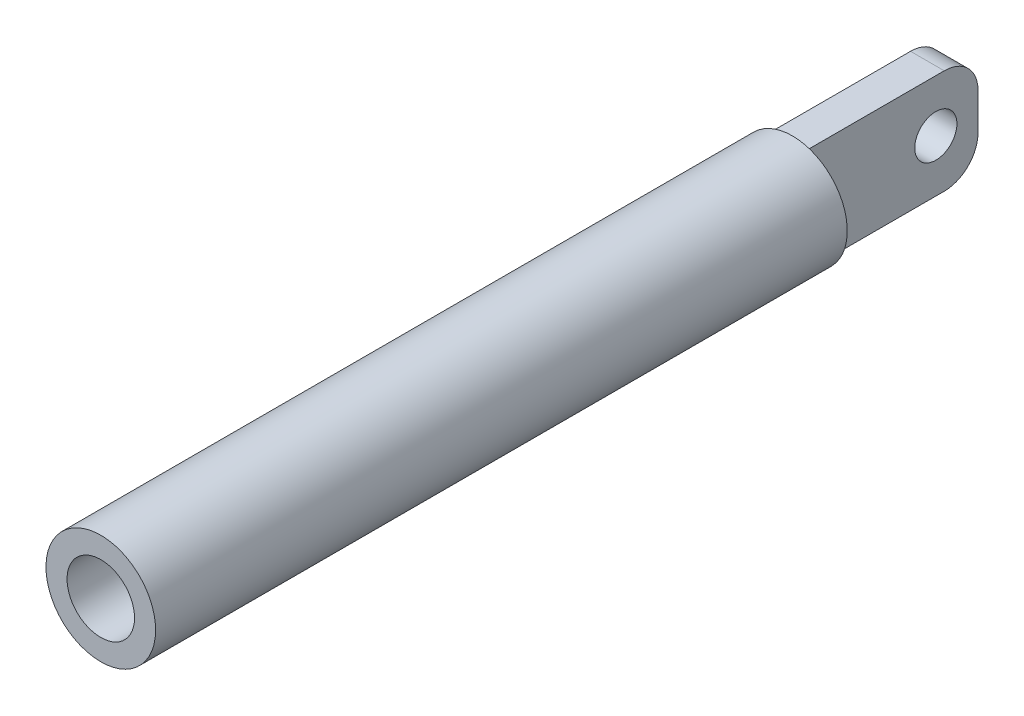
from build123d import *

# Parameters (mm, degrees)
SKETCH1_R           = 6.5
SKETCH1_R_2         = 4
BOSS_EXTRUDE1_DEPTH = 20
BOSS_EXTRUDE2_START = 62
SKETCH2_R           = 6.5
BOSS_EXTRUDE2_DEPTH = 62
SKETCH3_W           = 4
SKETCH3_H           = 12.369316876
BOSS_EXTRUDE3_DEPTH = 20
FILLET1_R           = 4
SKETCH4_R           = 2.5
CUT_EXTRUDE1_DEPTH  = 4


with BuildPart() as part:
    # Sketch1 → Boss-Extrude1 (new body)
    with BuildSketch(Plane.XY):
        Circle(SKETCH1_R)
        Circle(SKETCH1_R_2, mode=Mode.SUBTRACT)
    extrude(amount=BOSS_EXTRUDE1_DEPTH)

    # Sketch2 → Boss-Extrude2 (add)
    with BuildSketch(Plane(origin=(0, 0, 0), x_dir=(-1, 0, 0), z_dir=(0, 0, -1)).offset(BOSS_EXTRUDE2_START)):
        Circle(SKETCH2_R)
    extrude(amount=-BOSS_EXTRUDE2_DEPTH)

    # Sketch3 → Boss-Extrude3 (add)
    with BuildSketch(Plane(origin=(0, 0, -62), x_dir=(-1, 0, 0), z_dir=(0, 0, -1))):
        Rectangle(SKETCH3_W, SKETCH3_H)
    extrude(amount=BOSS_EXTRUDE3_DEPTH)

    # Fillet1
    fillet1_edges = [part.edges().sort_by_distance(p)[0] for p in [
        (0, 6.184658438, -82),
        (0, -6.184658438, -82),
    ]]
    fillet(fillet1_edges, radius=FILLET1_R)

    # Sketch4 → Cut-Extrude1 (cut)
    with BuildSketch(Plane(origin=(2, 0, 0), x_dir=(0, 0, -1), z_dir=(1, 0, 0))):
        with Locations((77, 0)):
            Circle(SKETCH4_R)
    extrude(amount=-CUT_EXTRUDE1_DEPTH, mode=Mode.SUBTRACT)


solid = part.part
